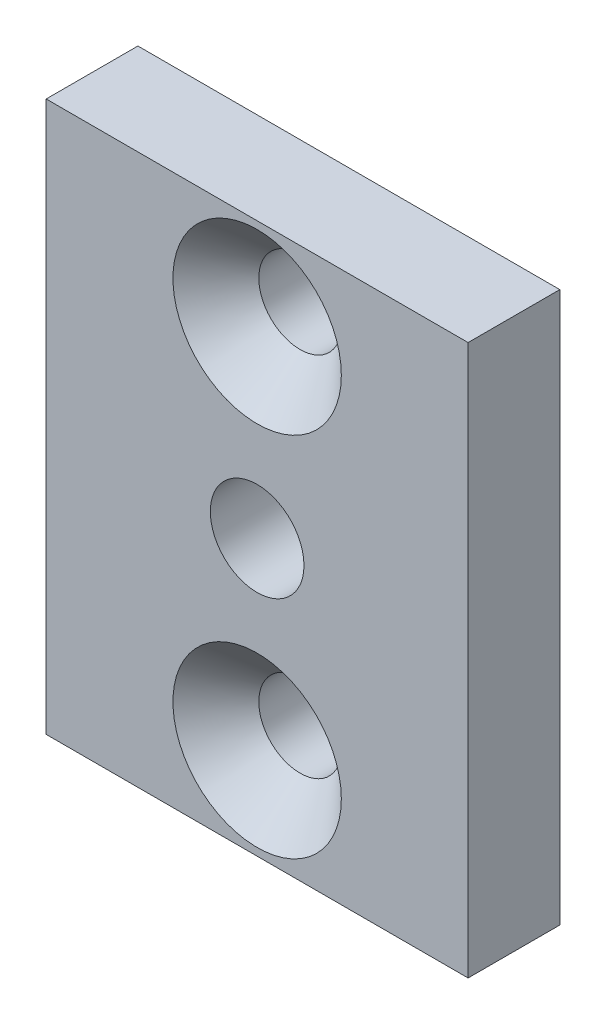
from build123d import *

# Parameters (mm, degrees)
SKIZZE1_W                                            = 23
SKIZZE1_H                                            = 30
AUFSATZ_LINEAR_AUSTRAGEN1_DEPTH                      = 5
FORMSENKUNG_F_R_M4_SENKSCHRAUBE_MIT_INNE_D           = 4.5
FORMSENKUNG_F_R_M4_SENKSCHRAUBE_MIT_INNE_CSINK_D     = 9.18
FORMSENKUNG_F_R_M4_SENKSCHRAUBE_MIT_INNE_CSINK_ANGLE = 90
F_1_4_20_GEWINDEBOHRUNG1_D                           = 5.1054


with BuildPart() as part:
    # Skizze1 → Aufsatz-Linear austragen1 (new body)
    with BuildSketch(Plane.XY):
        with Locations((11.5, 15)):
            Rectangle(SKIZZE1_W, SKIZZE1_H)
    extrude(amount=AUFSATZ_LINEAR_AUSTRAGEN1_DEPTH)

    # Formsenkung für M4 Senkschraube mit Innensechskant1 (through all)
    with Locations(Plane.XY.offset(5)):
        with Locations((11.5, 25), (11.5, 5)):
            CounterSinkHole(FORMSENKUNG_F_R_M4_SENKSCHRAUBE_MIT_INNE_D / 2, FORMSENKUNG_F_R_M4_SENKSCHRAUBE_MIT_INNE_CSINK_D / 2, counter_sink_angle=FORMSENKUNG_F_R_M4_SENKSCHRAUBE_MIT_INNE_CSINK_ANGLE)

    # 1/4-20 Gewindebohrung1 (through all)
    with Locations(Plane.XY.offset(5)):
        with Locations((11.5, 15)):
            Hole(F_1_4_20_GEWINDEBOHRUNG1_D / 2)


solid = part.part
